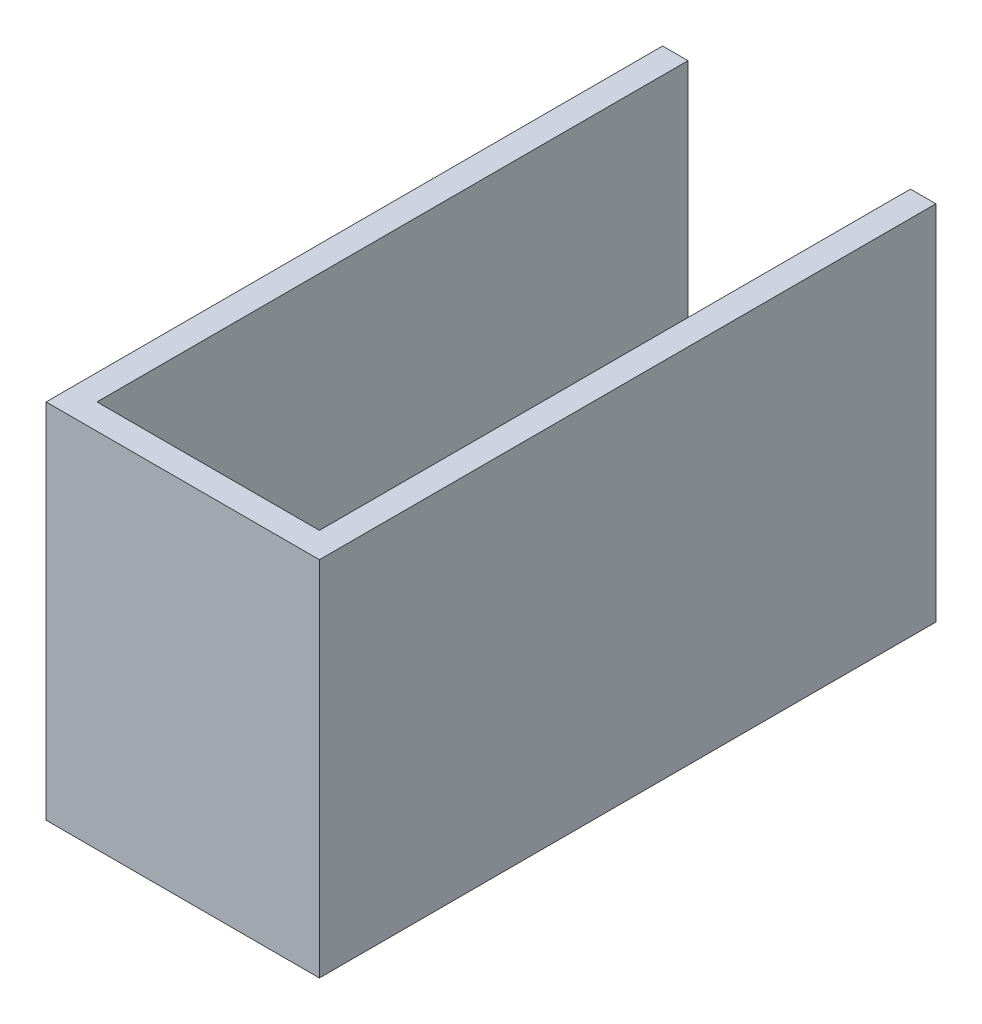
from build123d import *

# Parameters (mm, degrees)
SKETCH2_W           = 21.5
SKETCH2_H           = 28.5
BOSS_EXTRUDE6_DEPTH = 48.5
CUT_EXTRUDE5_DEPTH  = 46.5
SKETCH5_R           = 1.45
BOSS_EXTRUDE7_DEPTH = 5


with BuildPart() as part:
    # Sketch2 → Boss-Extrude6 (new body)
    with BuildSketch(Plane.XY):
        with Locations((10.75, 14.25)):
            Rectangle(SKETCH2_W, SKETCH2_H)
    extrude(amount=BOSS_EXTRUDE6_DEPTH)

    # 3DSketch6 → Cut-Extrude5 (cut)
    with BuildSketch(Plane(origin=(19.5, 2, 0), x_dir=(-0.5510615347417098, 0.8344646097517326, 0), z_dir=(0, 0, 1))):
        Polygon((0, 0), (22.113312158, -14.603130671), (31.756889016, 0), (9.643576858, 14.603130671), align=None)
    extrude(amount=CUT_EXTRUDE5_DEPTH, mode=Mode.SUBTRACT)

    # Sketch5 → Boss-Extrude7 (add)
    with BuildSketch(Plane(origin=(0, 0, 0), x_dir=(-1, 0, 0), z_dir=(0, -1, 0))):
        with Locations(Location((-10.75, -39.25, 0), (0, 0, 270))):
            Circle(SKETCH5_R)
        with Locations(Location((-10.75, -9.25, 0), (0, 0, 270))):
            Circle(SKETCH5_R)
    extrude(amount=BOSS_EXTRUDE7_DEPTH)


solid = part.part
